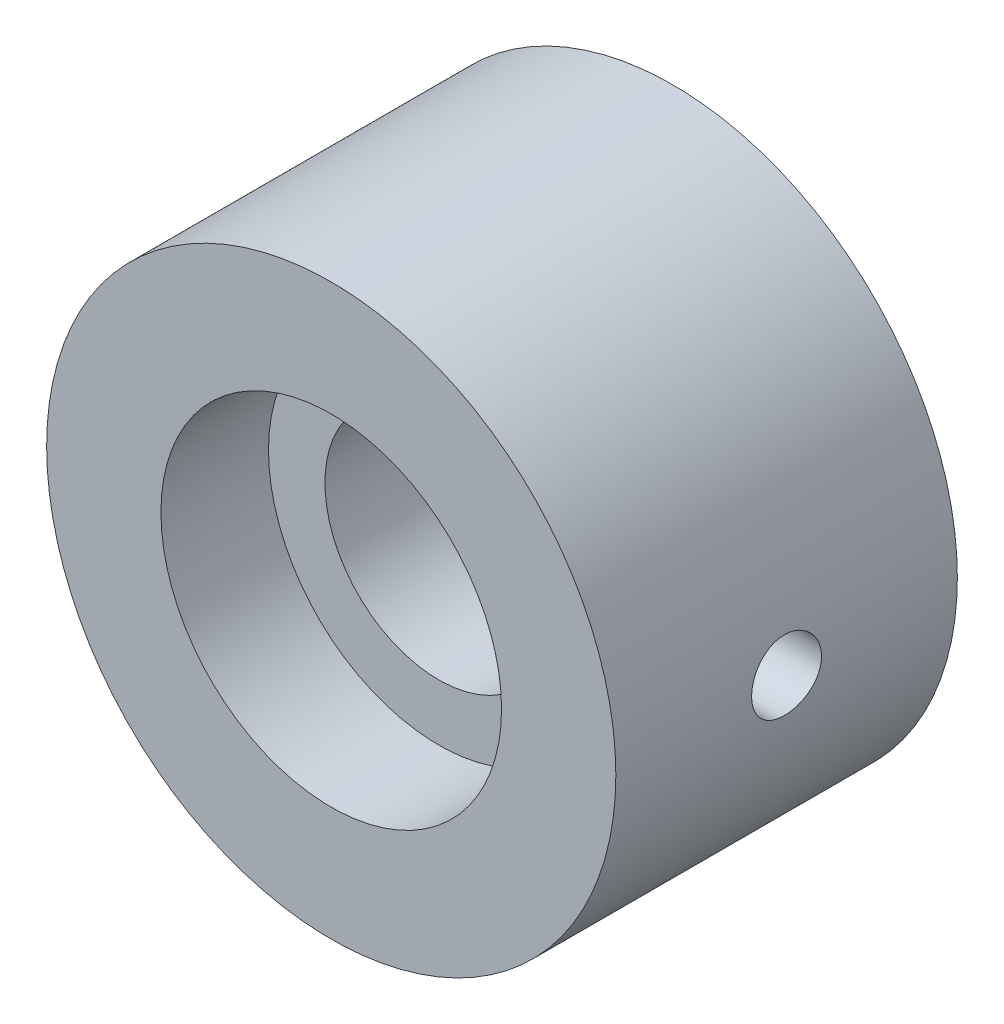
from build123d import *

# Parameters (mm, degrees)
SKETCH1_R               = 15.875
SKETCH1_R_2             = 9.5
BOSS_EXTRUDE1_DEPTH     = 6
BOSS_EXTRUDE2_START     = -13.050000062
SKETCH1_3_R             = 15.875
SKETCH1_3_R_2           = 6.35
BOSS_EXTRUDE2_DEPTH     = 13.050000062
SKETCH3_R               = 1.95
CUT_EXTRUDE1_DEPTH      = 10.16
CUT_EXTRUDE2_REACH      = 39.82
CUT_EXTRUDE2_END_RADIUS = 9.5
SKETCH4_R               = 1.95


with BuildPart() as part:
    # Sketch1 → Boss-Extrude1 (new body)
    with BuildSketch(Plane.XY):
        Circle(SKETCH1_R)
        Circle(SKETCH1_R_2, mode=Mode.SUBTRACT)
    extrude(amount=BOSS_EXTRUDE1_DEPTH)

    # Sketch1<3> → Boss-Extrude2 (add)
    with BuildSketch(Plane.XY.offset(BOSS_EXTRUDE2_START)):
        Circle(SKETCH1_3_R)
        Circle(SKETCH1_3_R_2, mode=Mode.SUBTRACT)
    extrude(amount=BOSS_EXTRUDE2_DEPTH)

    # Sketch3 → Cut-Extrude1 (cut)
    with BuildSketch(Plane(origin=(0, 0, -13.050000062), x_dir=(-1, 0, 0), z_dir=(0, 0, -1))):
        with Locations((0, 12.7)):
            Circle(SKETCH3_R)
        with Locations((0, -12.7)):
            Circle(SKETCH3_R)
    extrude(amount=-CUT_EXTRUDE1_DEPTH, mode=Mode.SUBTRACT)

    # Cut-Extrude2: up to this cylinder (the profile starts outside it)
    cut_extrude2_end = Plane(origin=(0, 0, -3.525), z_dir=(0, 0, -1)) * Cylinder(CUT_EXTRUDE2_END_RADIUS, 99.64, mode=Mode.PRIVATE)
    # Sketch4 → Cut-Extrude2 (cut, up to the surface)
    with BuildSketch(Plane(origin=(15.875, 0, 0), x_dir=(0, 0, -1), z_dir=(1, 0, 0)), mode=Mode.PRIVATE) as cut_extrude2_sk1:
        with Locations((3.525000031, 0)):
            Circle(SKETCH4_R)
    cut_extrude2_tool1 = extrude(cut_extrude2_sk1.sketch, amount=-CUT_EXTRUDE2_REACH, mode=Mode.PRIVATE) - cut_extrude2_end
    add(cut_extrude2_tool1.solids().sort_by_distance((15.875, 0, -3.525))[0], mode=Mode.SUBTRACT)


solid = part.part
